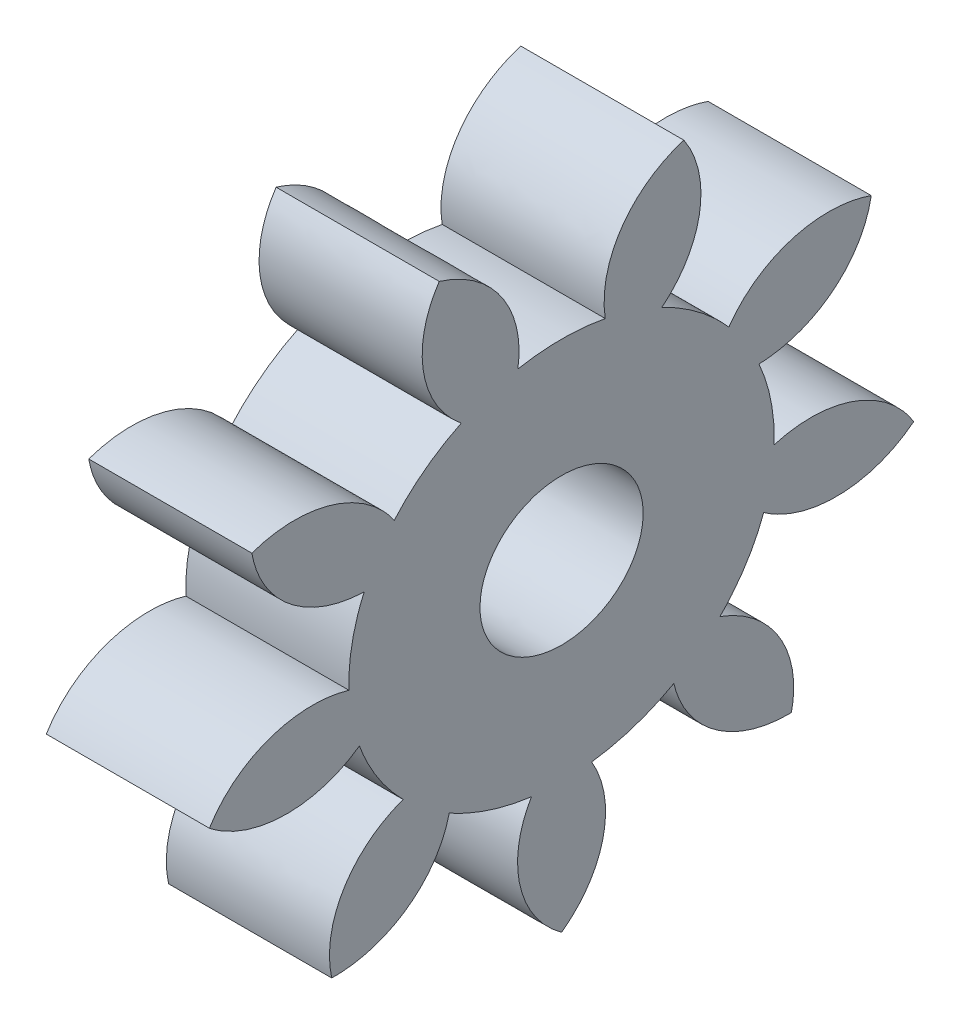
from build123d import *

# Parameters (mm, degrees)
BASPROSKE_W     = 3.175
BASPROSKE_H     = 6.985
TOOTHCUT_DEPTH  = 11.375985495
TEETHCUTS_COUNT = 9
BORSKE_R        = 1.5875
BORE_DEPTH      = 50.8000508
SCALE1_SCALE_X  = 1.11
SCALE1_SCALE_Y  = 1
SCALE1_SCALE_Z  = 1.11


with BuildPart() as part:
    # BasProSke → Base-Revolve (revolve)
    with BuildSketch(Plane(origin=(0, 0, 0), x_dir=(1, 0, 0), z_dir=(0, 1, 0)), mode=Mode.PRIVATE) as base_revolve_sk:
        with Locations((1.5875, 3.4925)):
            Rectangle(BASPROSKE_W, BASPROSKE_H)
    revolve(base_revolve_sk.sketch.rotate(Axis((-10, 0, 0), (1, 0, 0)), 180), axis=Axis((-10, 0, 0), (1, 0, 0)))

    # TooCutSke → ToothCut (cut, through all)
    with BuildSketch(Plane(origin=(0, 0, 0), x_dir=(0, 0, -1), z_dir=(1, 0, 0))):
        with BuildLine():
            ThreePointArc((0.85090004, 4.051817513), (0, 4.1402), (-0.85090004, 4.051817513))
            ThreePointArc((-0.85090004, 4.051817513), (-1.187930048, 5.606894235), (-2.458065659, 6.565334826))
            ThreePointArc((-2.458065659, 6.565334826), (0, 7.0104), (2.458065659, 6.565334826))
            ThreePointArc((2.458065659, 6.565334826), (1.187930048, 5.606894235), (0.85090004, 4.051817513))
        make_face()
    toothcut = extrude(amount=TOOTHCUT_DEPTH, mode=Mode.SUBTRACT)

    # TeethCuts: ToothCut ×9 about axis
    teethcuts_axis = Axis((-10, 0, 0), (1, 0, 0))
    for i in range(1, TEETHCUTS_COUNT):
        add(toothcut.rotate(teethcuts_axis, i * 360 / TEETHCUTS_COUNT), mode=Mode.SUBTRACT)

    # BorSke → Bore (cut, symmetric)
    with BuildSketch(Plane(origin=(0, 0, 0), x_dir=(0, 0, -1), z_dir=(1, 0, 0))):
        with Locations(Location((0, 0, 0), (0, 0, 180))):
            Circle(BORSKE_R)
    extrude(amount=BORE_DEPTH, both=True, mode=Mode.SUBTRACT)


with BuildPart() as part_1:
    # Scale1: scaled about (1.5875, 0, 0)
    add(part.part.scale((SCALE1_SCALE_X, SCALE1_SCALE_Y, SCALE1_SCALE_Z), about=(1.5875, 0, 0)))


solid = part_1.part
